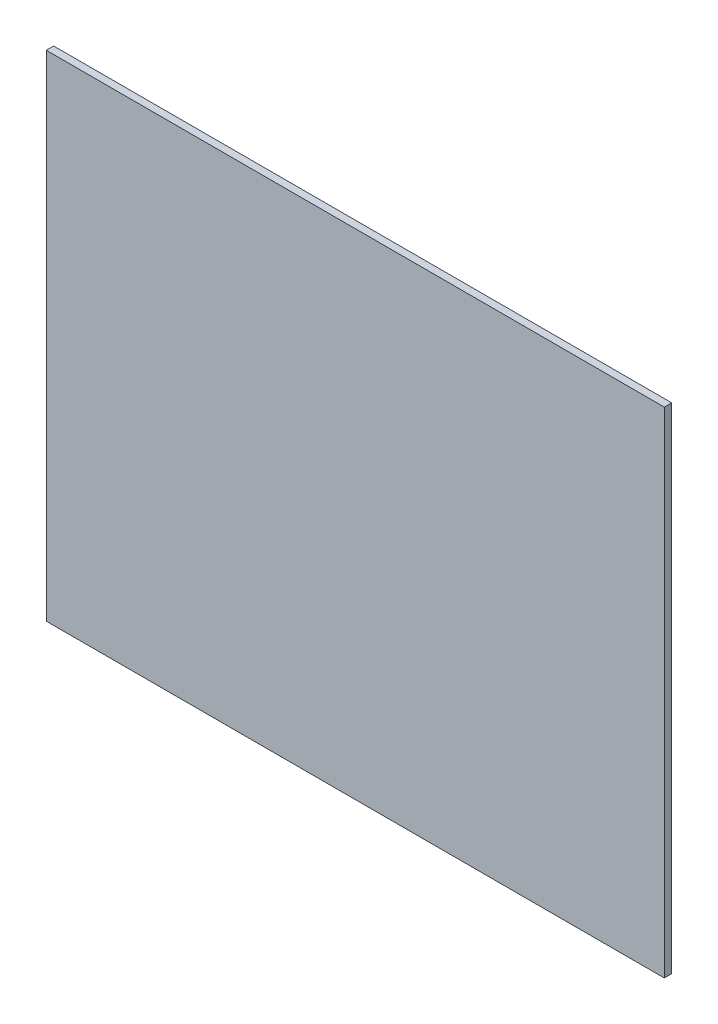
from build123d import *

# Parameters (mm, degrees)
SKETCH1_W           = 250
SKETCH1_H           = 200
BOSS_EXTRUDE1_DEPTH = 3


with BuildPart() as part:
    # Sketch1 → Boss-Extrude1 (new body)
    with BuildSketch(Plane.XY):
        Rectangle(SKETCH1_W, SKETCH1_H)
    extrude(amount=BOSS_EXTRUDE1_DEPTH)


solid = part.part
